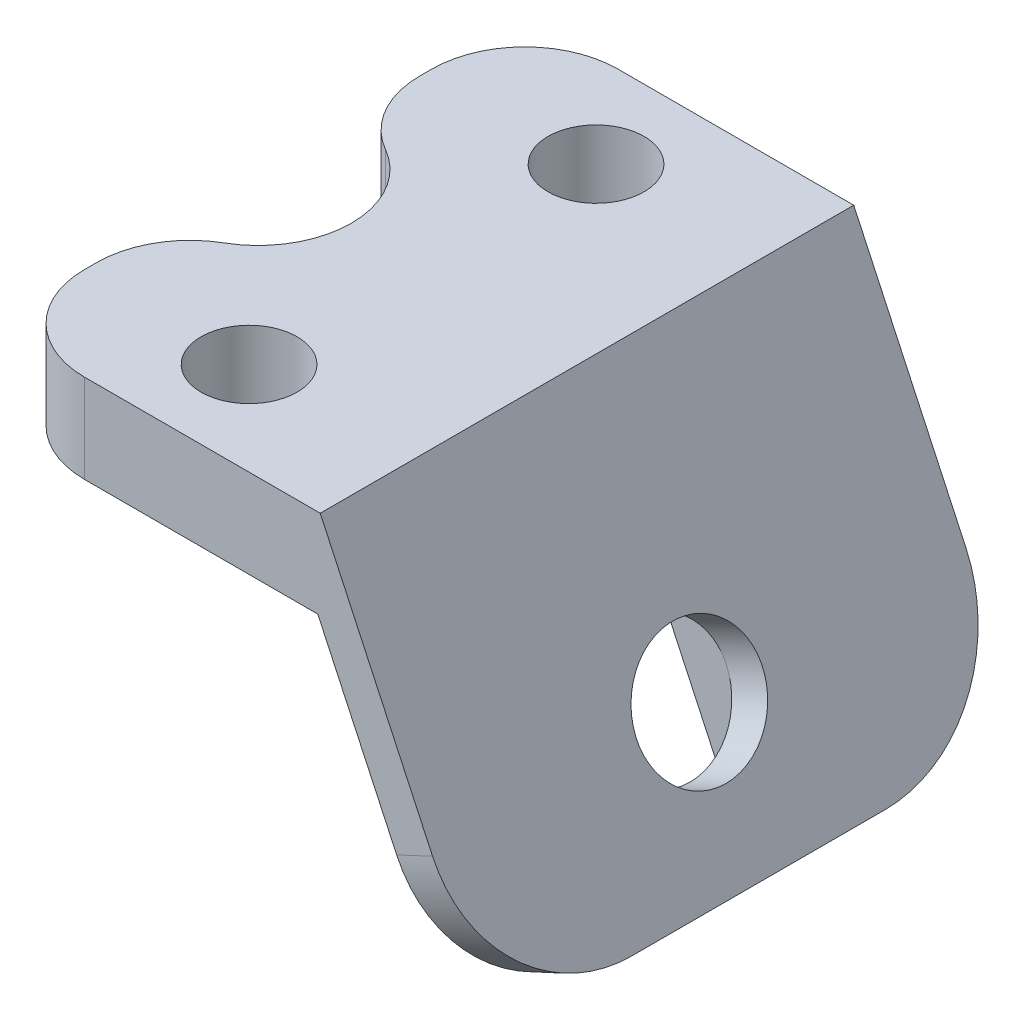
from build123d import *

# Parameters (mm, degrees)
BOSS_EXTRUDE1_DEPTH = 29.057599999999997
SKETCH3_R           = 3.4290000000000025
CUT_EXTRUDE2_DEPTH  = 40.78888094416812
SKETCH3_3_W         = 15.239999999999998
SKETCH3_3_H         = 3.8099999999999987
SKETCH3_3_W_2       = 15.239999999999997
SKETCH3_3_H_2       = 3.8100000000000014
BOSS_EXTRUDE2_DEPTH = 2.54
SKETCH2_R           = 2.6161999999999974
CUT_EXTRUDE1_DEPTH  = 46.51431433261163
FILLET7_R           = 5.08
FILLET8_R           = 7.619999999999999
SKETCH4_R           = 5.08
CUT_EXTRUDE3_DEPTH  = 10.16
FILLET9_R           = 5.08


with BuildPart() as part:
    # Sketch1 → Boss-Extrude1 (new body)
    with BuildSketch(Plane.XY):
        Polygon((0, 0), (0, 4.826), (17.91179216878401, 4.825999999999999), (27.250871205961722, -15.201719626413484), (25.29415269374959, -16.114152453511647), (17.779999999999998, 7.8e-16), align=None)
    extrude(amount=BOSS_EXTRUDE1_DEPTH)

    # Sketch3 → Cut-Extrude2 (cut, through all)
    with BuildSketch(Plane(origin=(14.604381850113365, 6.810135099327686, 0), x_dir=(0.4226182617406973, -0.9063077870366509, 0), z_dir=(-0.906307787036651, -0.42261826174069733, 0))):
        with Locations((17.674152693749598, 14.528799999999999)):
            Circle(SKETCH3_R)
    extrude(amount=-CUT_EXTRUDE2_DEPTH, mode=Mode.SUBTRACT)

    # Sketch3<3> → Boss-Extrude2 (add)
    with BuildSketch(Plane(origin=(14.604381850113365, 6.810135099327686, 0), x_dir=(0.4226182617406973, -0.9063077870366509, 0), z_dir=(-0.906307787036651, -0.42261826174069733, 0))):
        with Locations((17.67415269374959, 19.8628)):
            Rectangle(SKETCH3_3_W, SKETCH3_3_H)
        with Locations((17.674152693749594, 9.194799999999997)):
            Rectangle(SKETCH3_3_W_2, SKETCH3_3_H_2)
    extrude(amount=BOSS_EXTRUDE2_DEPTH)

    # Sketch2 → Cut-Extrude1 (cut, through all)
    with BuildSketch(Plane(origin=(2.3e-16, 4.826, 0), x_dir=(1, 0, 0), z_dir=(0, 1, 0))):
        with Locations((8.955896084392007, -5.079999999999997)):
            Circle(SKETCH2_R)
        with Locations((8.955896084392007, -23.9776)):
            Circle(SKETCH2_R)
    extrude(amount=-CUT_EXTRUDE1_DEPTH, mode=Mode.SUBTRACT)

    # Fillet7
    fillet7_edges = [part.edges().sort_by_distance(p)[0] for p in [
        (0, 2.413, 0),
        (0, 2.413, 29.057599999999997),
    ]]
    fillet(fillet7_edges, radius=FILLET7_R)

    # Fillet8
    fillet8_edges = [part.edges().sort_by_distance(p)[0] for p in [
        (26.272511949855655, -15.657936039962564, 0),
        (26.272511949855655, -15.657936039962564, 29.057599999999997),
    ]]
    fillet(fillet8_edges, radius=FILLET8_R)

    # Sketch4 → Cut-Extrude3 (cut)
    with BuildSketch(Plane(origin=(2.3e-16, 4.826, 0), x_dir=(1, 0, 0), z_dir=(0, 1, 0))):
        with Locations((0, -14.528799999999999)):
            Circle(SKETCH4_R)
    extrude(amount=-CUT_EXTRUDE3_DEPTH, mode=Mode.SUBTRACT)

    # Fillet9
    fillet9_edges = [part.edges().sort_by_distance(p)[0] for p in [
        (0, 2.413, 19.6088),
        (0, 2.413, 9.448799999999999),
    ]]
    fillet(fillet9_edges, radius=FILLET9_R)


solid = part.part
